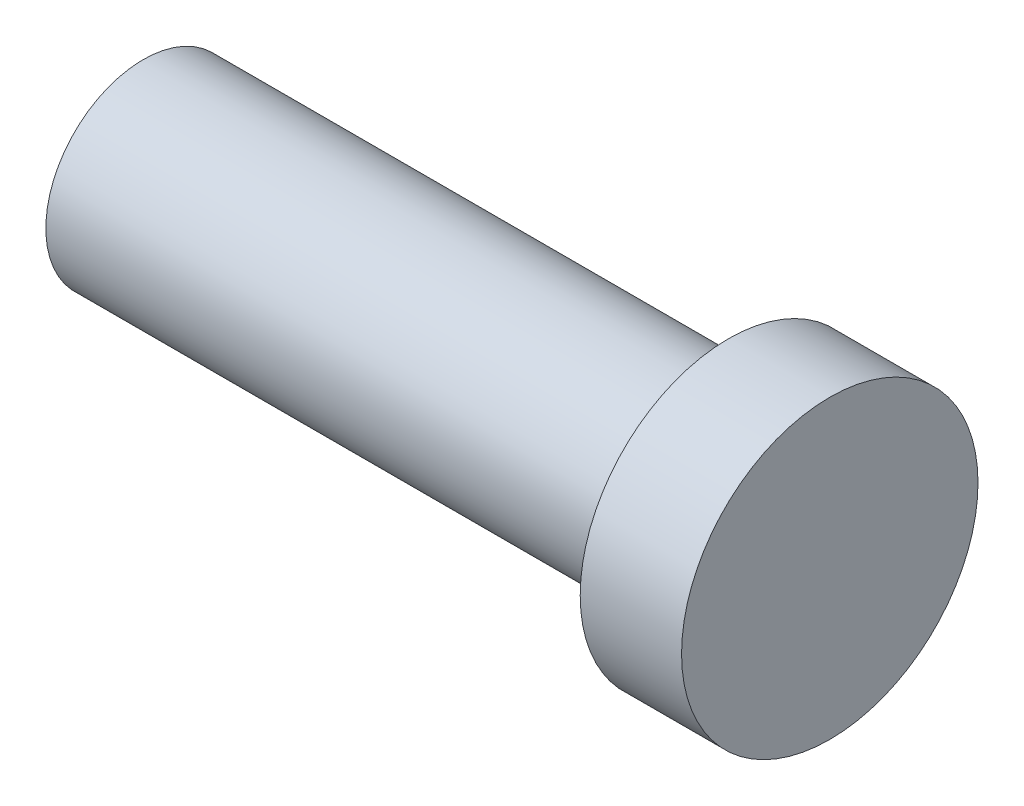
from build123d import *

# Parameters (mm, degrees)
SKETCH1_R           = 4.826
BOSS_EXTRUDE1_DEPTH = 3.3
SKETCH2_R           = 3.175
BOSS_EXTRUDE2_DEPTH = 19.05


with BuildPart() as part:
    # Sketch1 → Boss-Extrude1 (new body)
    with BuildSketch(Plane(origin=(0, 0, 0), x_dir=(0, 0, -1), z_dir=(1, 0, 0))):
        Circle(SKETCH1_R)
    extrude(amount=-BOSS_EXTRUDE1_DEPTH)

    # Sketch2 → Boss-Extrude2 (add)
    with BuildSketch(Plane.ZY.offset(3.3)):
        with Locations(Location((0, 0, 0), (0, 0, 180))):
            Circle(SKETCH2_R)
    extrude(amount=BOSS_EXTRUDE2_DEPTH)


solid = part.part
